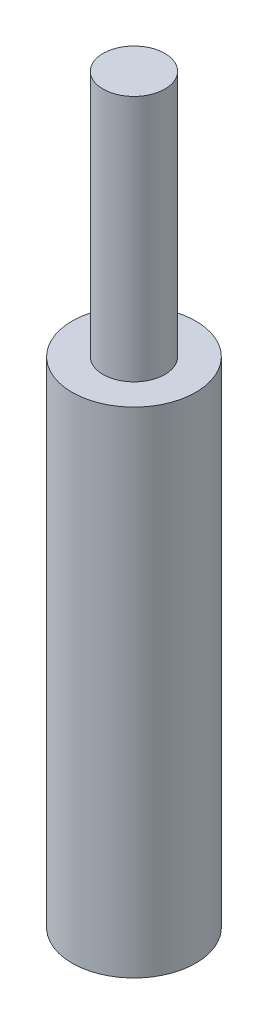
from build123d import *

# Parameters (mm, degrees)
SKETCH1_R                        = 3.175
BOSS_EXTRUDE1_DEPTH              = 25.4
SKETCH2_R                        = 1.5875
BOSS_EXTRUDE2_DEPTH              = 12.7
F_1_8_0_125_DIAMETER_HOLE1_D     = 3.175
F_1_8_0_125_DIAMETER_HOLE1_DEPTH = 12.7
F_1_8_0_125_DIAMETER_HOLE1_TIP   = 0.953866233


with BuildPart() as part:
    # Sketch1 → Boss-Extrude1 (new body)
    with BuildSketch(Plane(origin=(0, 0, 0), x_dir=(1, 0, 0), z_dir=(0, 1, 0))):
        with Locations(Location((0, 0, 0), (0, 0, 270))):
            Circle(SKETCH1_R)
    extrude(amount=BOSS_EXTRUDE1_DEPTH)

    # Sketch2 → Boss-Extrude2 (add)
    with BuildSketch(Plane(origin=(0, 25.4, 0), x_dir=(1, 0, 0), z_dir=(0, 1, 0))):
        with Locations(Location((0, 0, 0), (0, 0, 270))):
            Circle(SKETCH2_R)
    extrude(amount=BOSS_EXTRUDE2_DEPTH)

    # 1/8 (0.125) Diameter Hole1
    with Locations(Plane.XZ):
        with Locations((0, 0)):
            Hole(F_1_8_0_125_DIAMETER_HOLE1_D / 2, depth=F_1_8_0_125_DIAMETER_HOLE1_DEPTH)
            with Locations((0, 0, -(F_1_8_0_125_DIAMETER_HOLE1_DEPTH + F_1_8_0_125_DIAMETER_HOLE1_TIP / 2))):  # 118° drill point
                Cone(0, F_1_8_0_125_DIAMETER_HOLE1_D / 2, F_1_8_0_125_DIAMETER_HOLE1_TIP, mode=Mode.SUBTRACT)


solid = part.part
